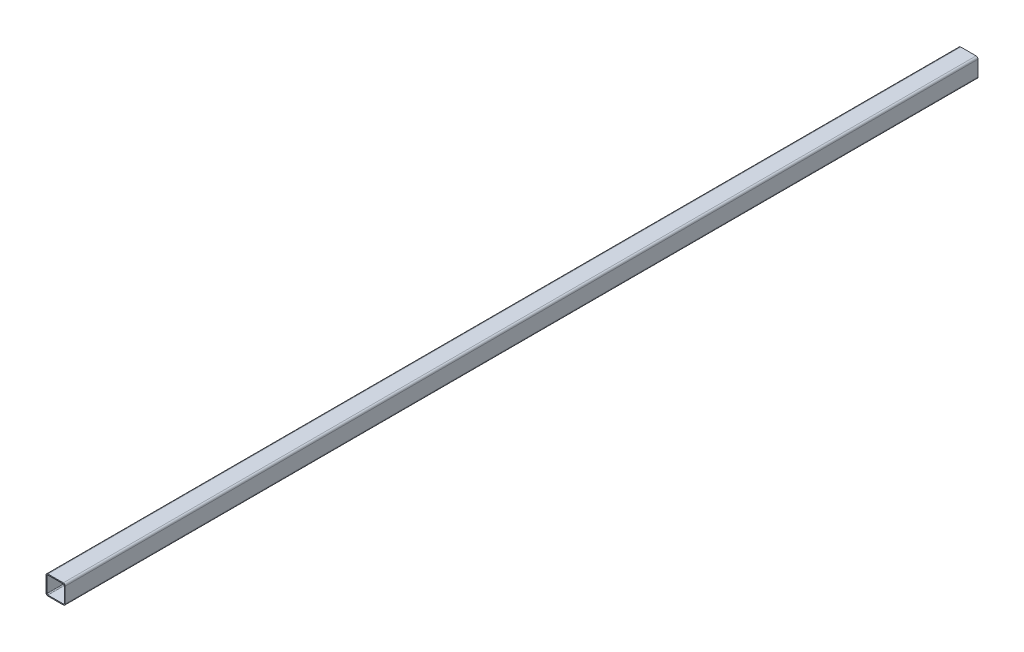
from build123d import *

# Parameters (mm, degrees)
Y_KSEKLIK_EKSTR_ZYON1_DEPTH = 1900


with BuildPart() as part:
    # Çizim1 → Yükseklik-Ekstrüzyon1 (new body)
    with BuildSketch(Plane.XY):
        with BuildLine():
            Line((-16, 20), (16, 20))
            ThreePointArc((16, 20), (18.828427125, 18.828427125), (20, 16))
            Line((20, 16), (20, -16))
            ThreePointArc((20, -16), (18.828427125, -18.828427125), (16, -20))
            Line((16, -20), (-16, -20))
            ThreePointArc((-16, -20), (-18.828427125, -18.828427125), (-20, -16))
            Line((-20, -16), (-20, 16))
            ThreePointArc((-20, 16), (-18.828427125, 18.828427125), (-16, 20))
        make_face()
        with BuildLine():
            Line((-18, 16), (-18, -16))
            ThreePointArc((-18, -16), (-17.414213562, -17.414213562), (-16, -18))
            Line((-16, -18), (16, -18))
            ThreePointArc((16, -18), (17.414213562, -17.414213562), (18, -16))
            Line((18, -16), (18, 16))
            ThreePointArc((18, 16), (17.414213562, 17.414213562), (16, 18))
            Line((16, 18), (-16, 18))
            ThreePointArc((-16, 18), (-17.414213562, 17.414213562), (-18, 16))
        make_face(mode=Mode.SUBTRACT)
    extrude(amount=Y_KSEKLIK_EKSTR_ZYON1_DEPTH)


solid = part.part
